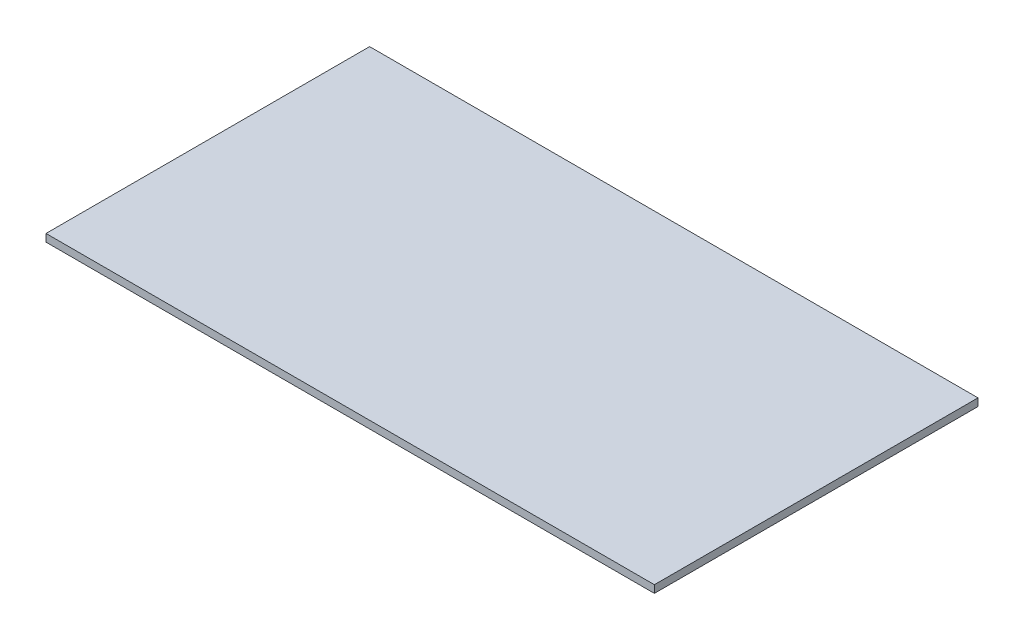
from build123d import *

# Parameters (mm, degrees)
SKETCH1_W           = 127
SKETCH1_H           = 67.55319149
BOSS_EXTRUDE1_DEPTH = 1.5748


with BuildPart() as part:
    # Sketch1 → Boss-Extrude1 (new body)
    with BuildSketch(Plane(origin=(0, 0, 0), x_dir=(1, 0, 0), z_dir=(0, 1, 0))):
        Rectangle(SKETCH1_W, SKETCH1_H)
    extrude(amount=BOSS_EXTRUDE1_DEPTH)


solid = part.part
